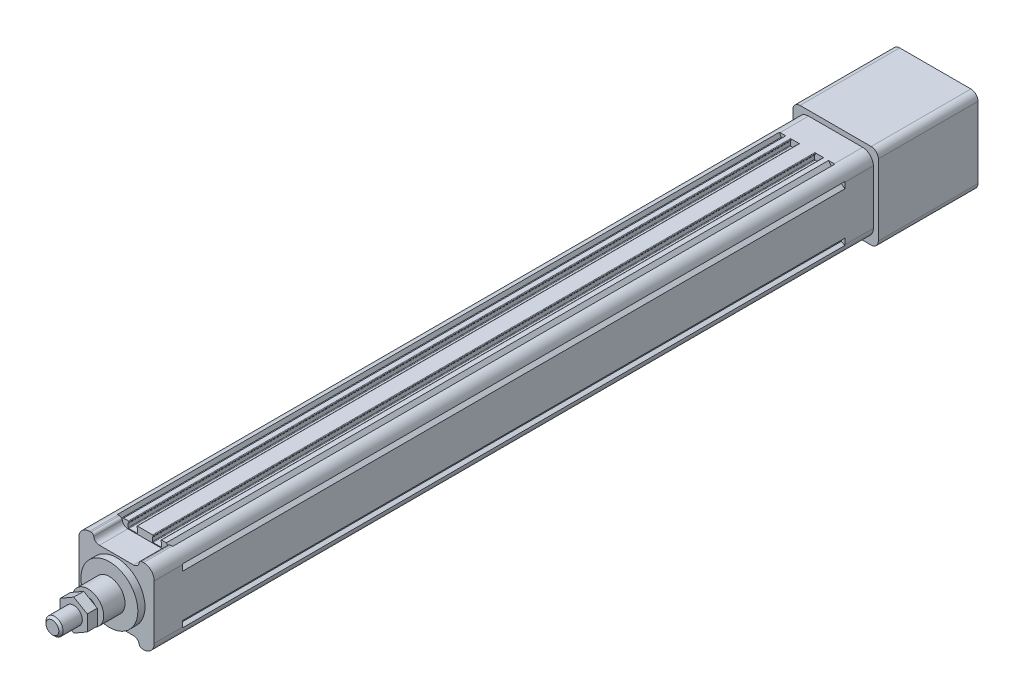
from build123d import *

# Parameters (mm, degrees)
SKETCH_1_R             = 2.1
EXTRUDE_1_DEPTH        = 465
EXTRUDE_2_DEPTH        = 20
SKETCH_7_R             = 20
EXTRUDE_3_DEPTH        = 5
SKETCH_9_R             = 11
EXTRUDE_4_DEPTH        = 15
SKETCH_10_R            = 6
EXTRUDE_5_DEPTH        = 25
EXTRUDE_START          = 20
EXTRUDE_6_DEPTH        = 20
EXTRUDE_7_DEPTH        = 70
SKETCH_14_R            = 19
CUT_EXTRUDE_2_DEPTH    = 70
HOLE_WIZARD_M6_1_D     = 5
HOLE_WIZARD_M6_1_DEPTH = 15
HOLE_WIZARD_M6_1_TIP   = 1.502151548
CHAMFER_1_SIZE         = 1.5
EXTRUDE_START_2        = 3
EXTRUDE_8_DEPTH        = 7


with BuildPart() as part:
    # 草图1 → 凸台-拉伸1 (new body)
    with BuildSketch(Plane.XY):
        with BuildLine():
            Line((-18.2, 24), (-19.443439638, 26.486879276))
            ThreePointArc((-19.443439638, 26.486879276), (-24.303300859, 24.303300859), (-26.486879276, 19.443439638))
            Line((-26.486879276, 19.443439638), (-24, 18.2))
            Line((-24, 18.2), (-24, 17.1))
            Line((-24, 17.1), (-26.5, 15))
            Line((-26.5, 15), (-26.5, -15))
            Line((-26.5, -15), (-24, -17.1))
            Line((-24, -17.1), (-24, -18.2))
            Line((-24, -18.2), (-26.486879276, -19.443439638))
            ThreePointArc((-26.486879276, -19.443439638), (-24.303300859, -24.303300859), (-19.443439638, -26.486879276))
            Line((-19.443439638, -26.486879276), (-18.2, -24))
            Line((-18.2, -24), (-17.1, -24))
            Line((-17.1, -24), (-15, -26.5))
            Line((-15, -26.5), (-11.65, -26.5))
            ThreePointArc((-11.65, -26.5), (-11.367157288, -26.382842712), (-11.25, -26.1))
            Line((-11.25, -26.1), (-11.25, -25.6))
            ThreePointArc((-11.25, -25.6), (-11.367157288, -25.317157288), (-11.65, -25.2))
            Line((-11.65, -25.2), (-11.75, -25.2))
            Line((-11.75, -25.2), (-11.75, -22.4))
            ThreePointArc((-11.75, -22.4), (-11.632842712, -22.117157288), (-11.35, -22))
            Line((-11.35, -22), (-5.65, -22))
            ThreePointArc((-5.65, -22), (-5.367157288, -22.117157288), (-5.25, -22.4))
            Line((-5.25, -22.4), (-5.25, -25.2))
            Line((-5.25, -25.2), (-5.35, -25.2))
            ThreePointArc((-5.35, -25.2), (-5.632842712, -25.317157288), (-5.75, -25.6))
            Line((-5.75, -25.6), (-5.75, -26.1))
            ThreePointArc((-5.75, -26.1), (-5.632842712, -26.382842712), (-5.35, -26.5))
            Line((-5.35, -26.5), (5.35, -26.5))
            ThreePointArc((5.35, -26.5), (5.632842712, -26.382842712), (5.75, -26.1))
            Line((5.75, -26.1), (5.75, -25.6))
            ThreePointArc((5.75, -25.6), (5.632842712, -25.317157288), (5.35, -25.2))
            Line((5.35, -25.2), (5.25, -25.2))
            Line((5.25, -25.2), (5.25, -22.4))
            ThreePointArc((5.25, -22.4), (5.367157288, -22.117157288), (5.65, -22))
            Line((5.65, -22), (11.35, -22))
            ThreePointArc((11.35, -22), (11.632842712, -22.117157288), (11.75, -22.4))
            Line((11.75, -22.4), (11.75, -25.2))
            Line((11.75, -25.2), (11.65, -25.2))
            ThreePointArc((11.65, -25.2), (11.367157288, -25.317157288), (11.25, -25.6))
            Line((11.25, -25.6), (11.25, -26.1))
            ThreePointArc((11.25, -26.1), (11.367157288, -26.382842712), (11.65, -26.5))
            Line((11.65, -26.5), (15, -26.5))
            Line((15, -26.5), (17.1, -24))
            Line((17.1, -24), (18.2, -24))
            Line((18.2, -24), (19.443439638, -26.486879276))
            ThreePointArc((19.443439638, -26.486879276), (24.303300859, -24.303300859), (26.486879276, -19.443439638))
            Line((26.486879276, -19.443439638), (24, -18.2))
            Line((24, -18.2), (24, -17.1))
            Line((24, -17.1), (26.5, -15))
            Line((26.5, -15), (26.5, 15))
            Line((26.5, 15), (24, 17.1))
            Line((24, 17.1), (24, 18.2))
            Line((24, 18.2), (26.486879276, 19.443439638))
            ThreePointArc((26.486879276, 19.443439638), (24.303300859, 24.303300859), (19.443439638, 26.486879276))
            Line((19.443439638, 26.486879276), (18.2, 24))
            Line((18.2, 24), (17.1, 24))
            Line((17.1, 24), (15, 26.5))
            Line((15, 26.5), (11.65, 26.5))
            ThreePointArc((11.65, 26.5), (11.367157288, 26.382842712), (11.25, 26.1))
            Line((11.25, 26.1), (11.25, 25.6))
            ThreePointArc((11.25, 25.6), (11.367157288, 25.317157288), (11.65, 25.2))
            Line((11.65, 25.2), (11.75, 25.2))
            Line((11.75, 25.2), (11.75, 22.4))
            ThreePointArc((11.75, 22.4), (11.632842712, 22.117157288), (11.35, 22))
            Line((11.35, 22), (5.65, 22))
            ThreePointArc((5.65, 22), (5.367157288, 22.117157288), (5.25, 22.4))
            Line((5.25, 22.4), (5.25, 25.2))
            Line((5.25, 25.2), (5.35, 25.2))
            ThreePointArc((5.35, 25.2), (5.632842712, 25.317157288), (5.75, 25.6))
            Line((5.75, 25.6), (5.75, 26.1))
            ThreePointArc((5.75, 26.1), (5.632842712, 26.382842712), (5.35, 26.5))
            Line((5.35, 26.5), (-5.35, 26.5))
            ThreePointArc((-5.35, 26.5), (-5.632842712, 26.382842712), (-5.75, 26.1))
            Line((-5.75, 26.1), (-5.75, 25.6))
            ThreePointArc((-5.75, 25.6), (-5.632842712, 25.317157288), (-5.35, 25.2))
            Line((-5.35, 25.2), (-5.25, 25.2))
            Line((-5.25, 25.2), (-5.25, 22.4))
            ThreePointArc((-5.25, 22.4), (-5.367157288, 22.117157288), (-5.65, 22))
            Line((-5.65, 22), (-11.35, 22))
            ThreePointArc((-11.35, 22), (-11.632842712, 22.117157288), (-11.75, 22.4))
            Line((-11.75, 22.4), (-11.75, 25.2))
            Line((-11.75, 25.2), (-11.65, 25.2))
            ThreePointArc((-11.65, 25.2), (-11.367157288, 25.317157288), (-11.25, 25.6))
            Line((-11.25, 25.6), (-11.25, 26.1))
            ThreePointArc((-11.25, 26.1), (-11.367157288, 26.382842712), (-11.65, 26.5))
            Line((-11.65, 26.5), (-15, 26.5))
            Line((-15, 26.5), (-17.1, 24))
            Line((-17.1, 24), (-18.2, 24))
        make_face()
        with Locations((19, 19)):
            Circle(SKETCH_1_R, mode=Mode.SUBTRACT)
        with Locations((19, -19)):
            Circle(SKETCH_1_R, mode=Mode.SUBTRACT)
        with Locations((-19, -19)):
            Circle(SKETCH_1_R, mode=Mode.SUBTRACT)
        with Locations((-19, 19)):
            Circle(SKETCH_1_R, mode=Mode.SUBTRACT)
        with BuildLine():
            Line((19.773719933, 3), (23.3, 3))
            Line((23.3, 3), (23.3, -3))
            Line((23.3, -3), (19.773719933, -3))
            ThreePointArc((19.773719933, -3), (0, -20), (-19.773719933, -3))
            Line((-19.773719933, -3), (-23.3, -3))
            Line((-23.3, -3), (-23.3, 3))
            Line((-23.3, 3), (-19.773719933, 3))
            ThreePointArc((-19.773719933, 3), (0, 20), (19.773719933, 3))
        make_face(mode=Mode.SUBTRACT)
    extrude(amount=EXTRUDE_1_DEPTH)

    # 草图6 → 凸台-拉伸2 (add)
    with BuildSketch(Plane.XY.offset(465)):
        with BuildLine():
            Line((-26.5, -19), (-26.5, 19))
            ThreePointArc((-26.5, 19), (-24.303300859, 24.303300859), (-19, 26.5))
            Line((-19, 26.5), (-17.916079783, 26.5))
            ThreePointArc((-17.916079783, 26.5), (-16.625085334, 26.027525232), (-15.944053189, 24.833333333))
            ThreePointArc((-15.944053189, 24.833333333), (-14.581988897, 22.444949537), (-12, 21.5))
            Line((-12, 21.5), (12, 21.5))
            ThreePointArc((12, 21.5), (14.581988897, 22.444949537), (15.944053189, 24.833333333))
            ThreePointArc((15.944053189, 24.833333333), (16.625085334, 26.027525232), (17.916079783, 26.5))
            Line((17.916079783, 26.5), (19, 26.5))
            ThreePointArc((19, 26.5), (24.303300859, 24.303300859), (26.5, 19))
            Line((26.5, 19), (26.5, -19))
            ThreePointArc((26.5, -19), (24.303300859, -24.303300859), (19, -26.5))
            Line((19, -26.5), (17.916079783, -26.5))
            ThreePointArc((17.916079783, -26.5), (16.625085334, -26.027525232), (15.944053189, -24.833333333))
            ThreePointArc((15.944053189, -24.833333333), (14.581988897, -22.444949537), (12, -21.5))
            Line((12, -21.5), (-12, -21.5))
            ThreePointArc((-12, -21.5), (-14.581988897, -22.444949537), (-15.944053189, -24.833333333))
            ThreePointArc((-15.944053189, -24.833333333), (-16.625085334, -26.027525232), (-17.916079783, -26.5))
            Line((-17.916079783, -26.5), (-19, -26.5))
            ThreePointArc((-19, -26.5), (-24.303300859, -24.303300859), (-26.5, -19))
        make_face()
    extrude(amount=EXTRUDE_2_DEPTH)

    # 草图7 → 凸台-拉伸3 (add)
    with BuildSketch(Plane.XY.offset(485)):
        Circle(SKETCH_7_R)
    extrude(amount=EXTRUDE_3_DEPTH)

    # 草图9 → 凸台-拉伸4 (add)
    with BuildSketch(Plane.XY.offset(490)):
        Circle(SKETCH_9_R)
    extrude(amount=EXTRUDE_4_DEPTH)

    # 草图10 → 凸台-拉伸5 (add)
    with BuildSketch(Plane.XY.offset(505)):
        Circle(SKETCH_10_R)
    extrude(amount=EXTRUDE_5_DEPTH)

    # 草图11 → 凸台-拉伸6 (add)
    with BuildSketch(Plane(origin=(0, 0, 0), x_dir=(-1, 0, 0), z_dir=(0, 0, -1)).offset(EXTRUDE_START)):
        with BuildLine():
            Line((-19, -26.5), (19, -26.5))
            ThreePointArc((19, -26.5), (24.303300859, -24.303300859), (26.5, -19))
            Line((26.5, -19), (26.5, 19))
            ThreePointArc((26.5, 19), (24.303300859, 24.303300859), (19, 26.5))
            Line((19, 26.5), (-19, 26.5))
            ThreePointArc((-19, 26.5), (-24.303300859, 24.303300859), (-26.5, 19))
            Line((-26.5, 19), (-26.5, -19))
            ThreePointArc((-26.5, -19), (-24.303300859, -24.303300859), (-19, -26.5))
        make_face()
    extrude(amount=-EXTRUDE_6_DEPTH)

    # 草图12 → 凸台-拉伸7 (add)
    with BuildSketch(Plane(origin=(0, 0, -20), x_dir=(-1, 0, 0), z_dir=(0, 0, -1))):
        with BuildLine():
            Line((-25, -30), (25, -30))
            ThreePointArc((25, -30), (28.535533906, -28.535533906), (30, -25))
            Line((30, -25), (30, 25))
            ThreePointArc((30, 25), (28.535533906, 28.535533906), (25, 30))
            Line((25, 30), (-25, 30))
            ThreePointArc((-25, 30), (-28.535533906, 28.535533906), (-30, 25))
            Line((-30, 25), (-30, -25))
            ThreePointArc((-30, -25), (-28.535533906, -28.535533906), (-25, -30))
        make_face()
    extrude(amount=EXTRUDE_7_DEPTH)

    # 草图14 → 切除-拉伸2 (cut)
    with BuildSketch(Plane(origin=(0, 0, -90), x_dir=(-1, 0, 0), z_dir=(0, 0, -1))):
        Circle(SKETCH_14_R)
    extrude(amount=-CUT_EXTRUDE_2_DEPTH, mode=Mode.SUBTRACT)

    # M6 螺纹孔1
    with Locations(Plane.ZY.offset(26.5)):
        with Locations((475, 11), (475, -11), (-10, 11), (-10, -11)):
            Hole(HOLE_WIZARD_M6_1_D / 2, depth=HOLE_WIZARD_M6_1_DEPTH)
            with Locations((0, 0, -(HOLE_WIZARD_M6_1_DEPTH + HOLE_WIZARD_M6_1_TIP / 2))):  # 118° drill point
                Cone(0, HOLE_WIZARD_M6_1_D / 2, HOLE_WIZARD_M6_1_TIP, mode=Mode.SUBTRACT)

    # 倒角1
    chamfer_1_edges = [part.edges().sort_by_distance(p)[0] for p in [
        (-6, 0, 530),
    ]]
    chamfer(chamfer_1_edges, length=CHAMFER_1_SIZE)

    # 草图17 → 凸台-拉伸8 (add)
    with BuildSketch(Plane.XY.offset(505).offset(EXTRUDE_START_2)):
        Polygon((0, 10.969655115), (-9.5, 5.484827557), (-9.5, -5.484827557), (0, -10.969655115), (9.5, -5.484827557), (9.5, 5.484827557), align=None)
    extrude(amount=EXTRUDE_8_DEPTH)


solid = part.part
